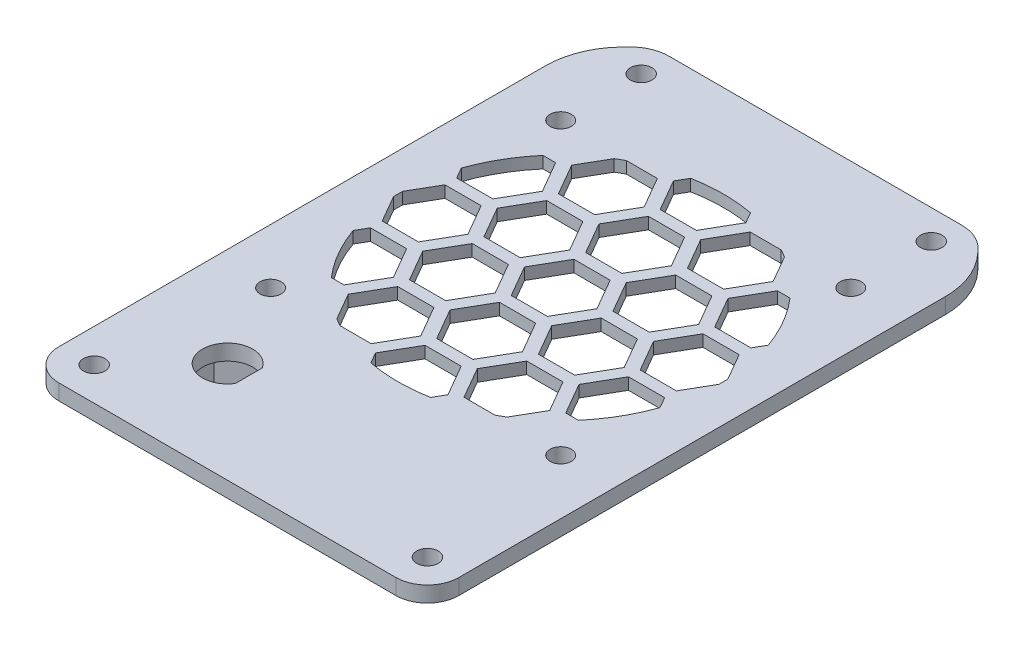
from build123d import *

# Parameters (mm, degrees)
SKETCH1_R           = 2.3
SKETCH1_R_2         = 1.375
BOSS_EXTRUDE1_DEPTH = 2
FILLET1_R           = 5
SKETCH2_R           = 20.75
CUT_EXTRUDE1_DEPTH  = 94.891068128
SKETCH3_R           = 21.75
CUT_EXTRUDE2_DEPTH  = 0.5
BOSS_EXTRUDE2_DEPTH = 1.5
CUT_EXTRUDE3_DEPTH  = 94.891068128
SKETCH9_R           = 6
BOSS_EXTRUDE3_DEPTH = 5
SKETCH10_R          = 1.35
CUT_EXTRUDE4_DEPTH  = 95.130402497


with BuildPart() as part:
    # Sketch1 → Boss-Extrude1 (new body)
    # profile 1 of 6: a face of its own
    with BuildSketch(Plane(origin=(0, -8.581230435, 0), x_dir=(1, 0, 0), z_dir=(0, 1, 0))):
        with BuildLine():
            ThreePointArc((-58.182284131, -69.6637936), (-57.010711255, -72.492220725), (-54.182284131, -73.6637936))
            Line((-54.182284131, -73.6637936), (-11.182284131, -73.6637936))
            ThreePointArc((-11.182284131, -73.6637936), (-8.353857006, -72.492220725), (-7.182284131, -69.6637936))
            Line((-7.182284131, -69.6637936), (-7.182284131, -7.605425406))
            ThreePointArc((-7.182284131, -7.605425406), (-7.878910366, -3.938378013), (-9.871731448, -0.782242903))
            Line((-9.871731448, -0.782242903), (-11.848950797, 1.3362064))
            Line((-11.848950797, 1.3362064), (-23.182284131, 1.3362064))
            Line((-23.182284131, 1.3362064), (-23.182284131, -1.176853978))
            Line((-23.182284131, -1.176853978), (-10.588989803, -9.070390216))
            ThreePointArc((-10.588989803, -9.070390216), (-9.557414326, -10.159717168), (-9.182284131, -11.612321211))
            Line((-9.182284131, -11.612321211), (-9.182284131, -59.6637936))
            Line((-9.182284131, -59.6637936), (-21.182284131, -71.6637936))
            Line((-21.182284131, -71.6637936), (-44.182284131, -71.6637936))
            Line((-44.182284131, -71.6637936), (-56.182284131, -59.6637936))
            Line((-56.182284131, -59.6637936), (-56.182284131, -11.612321211))
            ThreePointArc((-56.182284131, -11.612321211), (-55.807153936, -10.159717168), (-54.775578459, -9.070390216))
            Line((-54.775578459, -9.070390216), (-42.182284131, -1.176853978))
            Line((-42.182284131, -1.176853978), (-42.182284131, 1.3362064))
            Line((-42.182284131, 1.3362064), (-53.515617464, 1.3362064))
            Line((-53.515617464, 1.3362064), (-55.492836813, -0.782242903))
            ThreePointArc((-55.492836813, -0.782242903), (-57.485657896, -3.938378013), (-58.182284131, -7.605425406))
            Line((-58.182284131, -7.605425406), (-58.182284131, -69.6637936))
        make_face()
        with Locations((-11.432284131, -69.4137936)):
            Circle(SKETCH1_R, mode=Mode.SUBTRACT)
        with Locations((-14.182284131, -2.394149556)):
            Circle(SKETCH1_R, mode=Mode.SUBTRACT)
        with Locations((-53.932284131, -69.4137936)):
            Circle(SKETCH1_R, mode=Mode.SUBTRACT)
        with Locations((-51.182284131, -2.394149556)):
            Circle(SKETCH1_R, mode=Mode.SUBTRACT)
    # profile 2 of 6: a face of its own
    with BuildSketch(Plane(origin=(0, -8.581230435, 0), x_dir=(1, 0, 0), z_dir=(0, 1, 0))):
        with BuildLine():
            Line((-23.182284131, 1.3362064), (-42.182284131, 1.3362064))
            Line((-42.182284131, 1.3362064), (-42.182284131, -1.176853978))
            Line((-42.182284131, -1.176853978), (-54.775578459, -9.070390216))
            ThreePointArc((-54.775578459, -9.070390216), (-55.807153936, -10.159717168), (-56.182284131, -11.612321211))
            Line((-56.182284131, -11.612321211), (-56.182284131, -59.6637936))
            Line((-56.182284131, -59.6637936), (-44.182284131, -71.6637936))
            Line((-44.182284131, -71.6637936), (-21.182284131, -71.6637936))
            Line((-21.182284131, -71.6637936), (-9.182284131, -59.6637936))
            Line((-9.182284131, -59.6637936), (-9.182284131, -11.612321211))
            ThreePointArc((-9.182284131, -11.612321211), (-9.557414326, -10.159717168), (-10.588989803, -9.070390216))
            Line((-10.588989803, -9.070390216), (-23.182284131, -1.176853978))
            Line((-23.182284131, -1.176853978), (-23.182284131, 1.3362064))
        make_face()
    # profile 3 of 6: a face of its own
    with BuildSketch(Plane(origin=(0, -8.581230435, 0), x_dir=(1, 0, 0), z_dir=(0, 1, 0))):
        with Locations((-14.182284131, -2.394149556)):
            Circle(SKETCH1_R)
        with Locations(Location((-14.182284131, -2.394149556, 0), (0, 0, 270))):
            Circle(SKETCH1_R_2, mode=Mode.SUBTRACT)
    # profile 4 of 6: a face of its own
    with BuildSketch(Plane(origin=(0, -8.581230435, 0), x_dir=(1, 0, 0), z_dir=(0, 1, 0))):
        with Locations((-51.182284131, -2.394149556)):
            Circle(SKETCH1_R)
        with Locations(Location((-51.182284131, -2.394149556, 0), (0, 0, 270))):
            Circle(SKETCH1_R_2, mode=Mode.SUBTRACT)
    # profile 5 of 6: a face of its own
    with BuildSketch(Plane(origin=(0, -8.581230435, 0), x_dir=(1, 0, 0), z_dir=(0, 1, 0))):
        with Locations((-53.932284131, -69.4137936)):
            Circle(SKETCH1_R)
        with Locations(Location((-53.932284131, -69.4137936, 0), (0, 0, 270))):
            Circle(SKETCH1_R_2, mode=Mode.SUBTRACT)
    # profile 6 of 6: a face of its own
    with BuildSketch(Plane(origin=(0, -8.581230435, 0), x_dir=(1, 0, 0), z_dir=(0, 1, 0))):
        with Locations((-11.432284131, -69.4137936)):
            Circle(SKETCH1_R)
        with Locations(Location((-11.432284131, -69.4137936, 0), (0, 0, 270))):
            Circle(SKETCH1_R_2, mode=Mode.SUBTRACT)
    extrude(amount=BOSS_EXTRUDE1_DEPTH)

    # Fillet1
    fillet1_edges = [part.edges().sort_by_distance(p)[0] for p in [
        (-53.515617464, -7.581230435, -1.3362064),
        (-11.848950797, -7.581230435, -1.3362064),
    ]]
    fillet(fillet1_edges, radius=FILLET1_R)

    # Sketch2 → Cut-Extrude1 (cut, through all)
    with BuildSketch(Plane(origin=(0, -6.581230435, 0), x_dir=(1, 0, 0), z_dir=(0, 1, 0))):
        with Locations(Location((-32.682284131, -31.1637936, 0), (0, 0, 270))):
            Circle(SKETCH2_R)
    extrude(amount=-CUT_EXTRUDE1_DEPTH, mode=Mode.SUBTRACT)

    # Sketch3 → Cut-Extrude2 (cut)
    with BuildSketch(Plane.XZ.offset(8.581230435)):
        with Locations(Location((-32.682284131, 31.1637936, 0), (0, 0, 270))):
            Circle(SKETCH3_R)
    extrude(amount=-CUT_EXTRUDE2_DEPTH, mode=Mode.SUBTRACT)

    # Sketch4 → Boss-Extrude2 (add)
    with BuildSketch(Plane(origin=(0, -6.581230435, 0), x_dir=(1, 0, 0), z_dir=(0, 1, 0))):
        with BuildLine():
            Line((-42.55649296, -12.9137936), (-38.60012439, -12.9137936))
            Line((-38.60012439, -12.9137936), (-36.290723313, -16.9137936))
            Line((-36.290723313, -16.9137936), (-38.60012439, -20.9137936))
            Line((-38.60012439, -20.9137936), (-43.218926543, -20.9137936))
            Line((-43.218926543, -20.9137936), (-45.52832762, -16.9137936))
            Line((-45.52832762, -16.9137936), (-43.550143335, -13.487477912))
            ThreePointArc((-43.550143335, -13.487477912), (-46.157952051, -15.385046055), (-48.44021864, -17.6637936))
            Line((-48.44021864, -17.6637936), (-46.827365726, -17.6637936))
            Line((-46.827365726, -17.6637936), (-44.517964649, -21.6637936))
            Line((-44.517964649, -21.6637936), (-46.827365726, -25.6637936))
            Line((-46.827365726, -25.6637936), (-51.446167879, -25.6637936))
            Line((-51.446167879, -25.6637936), (-52.252594336, -24.267022004))
            ThreePointArc((-52.252594336, -24.267022004), (-53.084914305, -27.382896621), (-53.424352164, -30.590109288))
            Line((-53.424352164, -30.590109288), (-51.446167879, -27.1637936))
            Line((-51.446167879, -27.1637936), (-46.827365726, -27.1637936))
            Line((-46.827365726, -27.1637936), (-44.517964649, -31.1637936))
            Line((-44.517964649, -31.1637936), (-46.827365726, -35.1637936))
            Line((-46.827365726, -35.1637936), (-51.446167879, -35.1637936))
            Line((-51.446167879, -35.1637936), (-53.424352164, -31.737477912))
            ThreePointArc((-53.424352164, -31.737477912), (-53.084914305, -34.94469058), (-52.252594336, -38.060565196))
            Line((-52.252594336, -38.060565196), (-51.446167879, -36.6637936))
            Line((-51.446167879, -36.6637936), (-46.827365726, -36.6637936))
            Line((-46.827365726, -36.6637936), (-44.517964649, -40.6637936))
            Line((-44.517964649, -40.6637936), (-46.827365726, -44.6637936))
            Line((-46.827365726, -44.6637936), (-48.44021864, -44.6637936))
            ThreePointArc((-48.44021864, -44.6637936), (-46.157952051, -46.942541145), (-43.550143335, -48.840109288))
            Line((-43.550143335, -48.840109288), (-45.52832762, -45.4137936))
            Line((-45.52832762, -45.4137936), (-43.218926543, -41.4137936))
            Line((-43.218926543, -41.4137936), (-38.60012439, -41.4137936))
            Line((-38.60012439, -41.4137936), (-36.290723313, -45.4137936))
            Line((-36.290723313, -45.4137936), (-38.60012439, -49.4137936))
            Line((-38.60012439, -49.4137936), (-42.55649296, -49.4137936))
            ThreePointArc((-42.55649296, -49.4137936), (-39.609246384, -50.723438125), (-36.494659827, -51.560565196))
            Line((-36.494659827, -51.560565196), (-37.301086284, -50.1637936))
            Line((-37.301086284, -50.1637936), (-34.991685207, -46.1637936))
            Line((-34.991685207, -46.1637936), (-30.372883054, -46.1637936))
            Line((-30.372883054, -46.1637936), (-28.063481977, -50.1637936))
            Line((-28.063481977, -50.1637936), (-28.869908434, -51.560565196))
            ThreePointArc((-28.869908434, -51.560565196), (-25.755321877, -50.723438125), (-22.808075302, -49.4137936))
            Line((-22.808075302, -49.4137936), (-26.764443872, -49.4137936))
            Line((-26.764443872, -49.4137936), (-29.073844948, -45.4137936))
            Line((-29.073844948, -45.4137936), (-26.764443872, -41.4137936))
            Line((-26.764443872, -41.4137936), (-22.145641718, -41.4137936))
            Line((-22.145641718, -41.4137936), (-19.836240641, -45.4137936))
            Line((-19.836240641, -45.4137936), (-21.814424926, -48.840109288))
            ThreePointArc((-21.814424926, -48.840109288), (-19.20661621, -46.942541145), (-16.924349621, -44.6637936))
            Line((-16.924349621, -44.6637936), (-18.537202536, -44.6637936))
            Line((-18.537202536, -44.6637936), (-20.846603612, -40.6637936))
            Line((-20.846603612, -40.6637936), (-18.537202536, -36.6637936))
            Line((-18.537202536, -36.6637936), (-13.918400382, -36.6637936))
            Line((-13.918400382, -36.6637936), (-13.111973925, -38.060565196))
            ThreePointArc((-13.111973925, -38.060565196), (-12.279653956, -34.94469058), (-11.940216097, -31.737477912))
            Line((-11.940216097, -31.737477912), (-13.918400382, -35.1637936))
            Line((-13.918400382, -35.1637936), (-18.537202536, -35.1637936))
            Line((-18.537202536, -35.1637936), (-20.846603612, -31.1637936))
            Line((-20.846603612, -31.1637936), (-18.537202536, -27.1637936))
            Line((-18.537202536, -27.1637936), (-13.918400382, -27.1637936))
            Line((-13.918400382, -27.1637936), (-11.940216097, -30.590109288))
            ThreePointArc((-11.940216097, -30.590109288), (-12.279653956, -27.382896621), (-13.111973925, -24.267022004))
            Line((-13.111973925, -24.267022004), (-13.918400382, -25.6637936))
            Line((-13.918400382, -25.6637936), (-18.537202536, -25.6637936))
            Line((-18.537202536, -25.6637936), (-20.846603612, -21.6637936))
            Line((-20.846603612, -21.6637936), (-18.537202536, -17.6637936))
            Line((-18.537202536, -17.6637936), (-16.924349621, -17.6637936))
            ThreePointArc((-16.924349621, -17.6637936), (-19.20661621, -15.385046055), (-21.814424926, -13.487477912))
            Line((-21.814424926, -13.487477912), (-19.836240641, -16.9137936))
            Line((-19.836240641, -16.9137936), (-22.145641718, -20.9137936))
            Line((-22.145641718, -20.9137936), (-26.764443872, -20.9137936))
            Line((-26.764443872, -20.9137936), (-29.073844948, -16.9137936))
            Line((-29.073844948, -16.9137936), (-26.764443872, -12.9137936))
            Line((-26.764443872, -12.9137936), (-22.808075302, -12.9137936))
            ThreePointArc((-22.808075302, -12.9137936), (-25.755321877, -11.604149075), (-28.869908434, -10.767022004))
            Line((-28.869908434, -10.767022004), (-28.063481977, -12.1637936))
            Line((-28.063481977, -12.1637936), (-30.372883054, -16.1637936))
            Line((-30.372883054, -16.1637936), (-34.991685207, -16.1637936))
            Line((-34.991685207, -16.1637936), (-37.301086284, -12.1637936))
            Line((-37.301086284, -12.1637936), (-36.494659827, -10.767022004))
            ThreePointArc((-36.494659827, -10.767022004), (-39.609246384, -11.604149075), (-42.55649296, -12.9137936))
        make_face()
        Polygon((-30.372883054, -36.6637936), (-28.063481977, -40.6637936), (-30.372883054, -44.6637936), (-34.991685207, -44.6637936), (-37.301086284, -40.6637936), (-34.991685207, -36.6637936), align=None, mode=Mode.SUBTRACT)
        Polygon((-43.218926543, -31.9137936), (-38.60012439, -31.9137936), (-36.290723313, -35.9137936), (-38.60012439, -39.9137936), (-43.218926543, -39.9137936), (-45.52832762, -35.9137936), align=None, mode=Mode.SUBTRACT)
        Polygon((-26.764443872, -31.9137936), (-22.145641718, -31.9137936), (-19.836240641, -35.9137936), (-22.145641718, -39.9137936), (-26.764443872, -39.9137936), (-29.073844948, -35.9137936), align=None, mode=Mode.SUBTRACT)
        Polygon((-30.372883054, -27.1637936), (-28.063481977, -31.1637936), (-30.372883054, -35.1637936), (-34.991685207, -35.1637936), (-37.301086284, -31.1637936), (-34.991685207, -27.1637936), align=None, mode=Mode.SUBTRACT)
        Polygon((-43.218926543, -22.4137936), (-38.60012439, -22.4137936), (-36.290723313, -26.4137936), (-38.60012439, -30.4137936), (-43.218926543, -30.4137936), (-45.52832762, -26.4137936), align=None, mode=Mode.SUBTRACT)
        Polygon((-30.372883054, -17.6637936), (-28.063481977, -21.6637936), (-30.372883054, -25.6637936), (-34.991685207, -25.6637936), (-37.301086284, -21.6637936), (-34.991685207, -17.6637936), align=None, mode=Mode.SUBTRACT)
        Polygon((-26.764443872, -22.4137936), (-22.145641718, -22.4137936), (-19.836240641, -26.4137936), (-22.145641718, -30.4137936), (-26.764443872, -30.4137936), (-29.073844948, -26.4137936), align=None, mode=Mode.SUBTRACT)
    extrude(amount=-BOSS_EXTRUDE2_DEPTH)

    # Sketch8 → Cut-Extrude3 (cut, through all)
    with BuildSketch(Plane(origin=(0, -6.581230435, 0), x_dir=(1, 0, 0), z_dir=(0, 1, 0))):
        with BuildLine():
            Line((-42.86605852, -62.480149736), (-42.86605852, -59.045036928))
            ThreePointArc((-42.86605852, -59.045036928), (-48.76605852, -60.762593332), (-42.86605852, -62.480149736))
        make_face()
    extrude(amount=-CUT_EXTRUDE3_DEPTH, mode=Mode.SUBTRACT)

    # Sketch9 → Boss-Extrude3 (add)
    with BuildSketch(Plane.XZ.offset(8.581230435)):
        with Locations(Location((-45.56605852, 60.762593332, 0), (0, 0, 90))):
            Circle(SKETCH9_R)
        Polygon((-45.56605852, 55.941718584), (-41.39105852, 58.352155958), (-41.39105852, 63.173030706), (-45.56605852, 65.58346808), (-49.74105852, 63.173030706), (-49.74105852, 58.352155958), align=None, mode=Mode.SUBTRACT)
    extrude(amount=BOSS_EXTRUDE3_DEPTH)

    # Sketch10 → Cut-Extrude4 (cut, through all)
    with BuildSketch(Plane(origin=(0, -6.581230435, 0), x_dir=(1, 0, 0), z_dir=(0, 1, 0))):
        with Locations(Location((-14.182284131, -49.6637936, 0), (0, 0, 270))):
            Circle(SKETCH10_R)
        with Locations(Location((-51.182284131, -49.6637936, 0), (0, 0, 270))):
            Circle(SKETCH10_R)
        with Locations(Location((-51.182284131, -12.6637936, 0), (0, 0, 270))):
            Circle(SKETCH10_R)
        with Locations(Location((-14.182284131, -12.6637936, 0), (0, 0, 270))):
            Circle(SKETCH10_R)
    extrude(amount=-CUT_EXTRUDE4_DEPTH, mode=Mode.SUBTRACT)


solid = part.part
